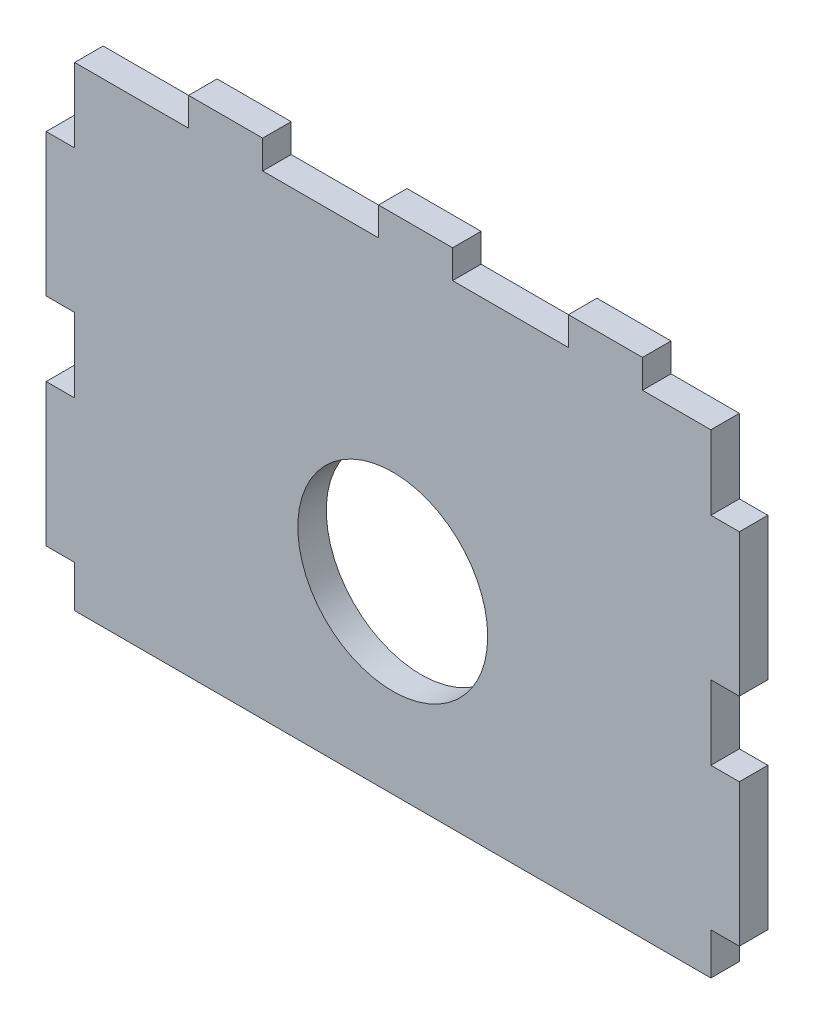
from build123d import *

# Parameters (mm, degrees)
SKETCH1_W           = 73
SKETCH1_H           = 50
BOSS_EXTRUDE1_DEPTH = 3
SKETCH2_W           = 3
SKETCH2_H           = 7.8
CUT_EXTRUDE1_DEPTH  = 53.999062732
LPATTERN1_COUNT     = 3
LPATTERN1_PITCH     = 22.8
SKETCH3_W           = 3
SKETCH3_H           = 7.8
CUT_EXTRUDE2_DEPTH  = 53.999062732
LPATTERN2_COUNT     = 4
LPATTERN2_PITCH     = 22.8
SKETCH6_W           = 3
SKETCH6_H           = 19.4
CUT_EXTRUDE3_DEPTH  = 10
SKETCH7_W           = 7.8
SKETCH7_H           = 3
BOSS_EXTRUDE2_DEPTH = 3
LPATTERN3_COUNT     = 3
LPATTERN3_PITCH     = 20
SKETCH8_W           = 3
SKETCH8_H           = 15
BOSS_EXTRUDE3_DEPTH = 3
CUT_EXTRUDE4_REACH  = 54.999
SKETCH9_R           = 10


with BuildPart() as part:
    # Sketch1 → Boss-Extrude1 (new body)
    with BuildSketch(Plane.XY):
        with Locations((-4.493460648, -8.457986111)):
            Rectangle(SKETCH1_W, SKETCH1_H)
    extrude(amount=BOSS_EXTRUDE1_DEPTH)

    # Sketch2 → Cut-Extrude1 (cut, through all)
    with BuildSketch(Plane.XY.offset(3)):
        with Locations((-39.493460648, 12.642013889)):
            Rectangle(SKETCH2_W, SKETCH2_H)
    cut_extrude1 = extrude(amount=-CUT_EXTRUDE1_DEPTH, mode=Mode.SUBTRACT)

    # LPattern1: Cut-Extrude1 ×3
    with Locations(*[(0, -i * LPATTERN1_PITCH, 0) for i in range(1, LPATTERN1_COUNT)]):
        add(cut_extrude1, mode=Mode.SUBTRACT)

    # Sketch3 → Cut-Extrude2 (cut, through all)
    with BuildSketch(Plane.XY.offset(3)):
        with Locations((30.506539352, 12.642013889)):
            Rectangle(SKETCH3_W, SKETCH3_H)
    cut_extrude2 = extrude(amount=-CUT_EXTRUDE2_DEPTH, mode=Mode.SUBTRACT)

    # LPattern2: Cut-Extrude2 ×4
    with Locations(*[(0, -i * LPATTERN2_PITCH, 0) for i in range(1, LPATTERN2_COUNT)]):
        add(cut_extrude2, mode=Mode.SUBTRACT)

    # Sketch6 → Cut-Extrude3 (cut)
    with BuildSketch(Plane.XY.offset(3)):
        with Locations((-39.493460648, -23.757986111)):
            Rectangle(SKETCH6_W, SKETCH6_H)
    extrude(amount=-CUT_EXTRUDE3_DEPTH, mode=Mode.SUBTRACT)

    # Sketch7 → Boss-Extrude2 (add)
    with BuildSketch(Plane(origin=(0, 16.542013889, 0), x_dir=(1, 0, 0), z_dir=(0, 1, 0))):
        with Locations((-22.093460648, -1.5)):
            Rectangle(SKETCH7_W, SKETCH7_H)
    boss_extrude2 = extrude(amount=BOSS_EXTRUDE2_DEPTH)

    # LPattern3: Boss-Extrude2 ×3
    with Locations(*[(i * LPATTERN3_PITCH, 0, 0) for i in range(1, LPATTERN3_COUNT)]):
        add(boss_extrude2)

    # Sketch8 → Boss-Extrude3 (add)
    with BuildSketch(Plane.ZY.offset(37.993460648)):
        with Locations((1.5, -21.557986111)):
            Rectangle(SKETCH8_W, SKETCH8_H)
    extrude(amount=BOSS_EXTRUDE3_DEPTH)

    # Sketch9 → Cut-Extrude4 (cut, up to next)
    with BuildSketch(Plane.XY.offset(3), mode=Mode.PRIVATE) as cut_extrude4_sk1:
        with Locations((-4.493460648, -14.057986111)):
            Circle(SKETCH9_R)
    cut_extrude4_tool1 = extrude(cut_extrude4_sk1.sketch, amount=-CUT_EXTRUDE4_REACH, mode=Mode.PRIVATE) & part.part
    add(cut_extrude4_tool1.solids().sort_by_distance((-4.493461, -14.057986, 3))[0], mode=Mode.SUBTRACT)


solid = part.part
